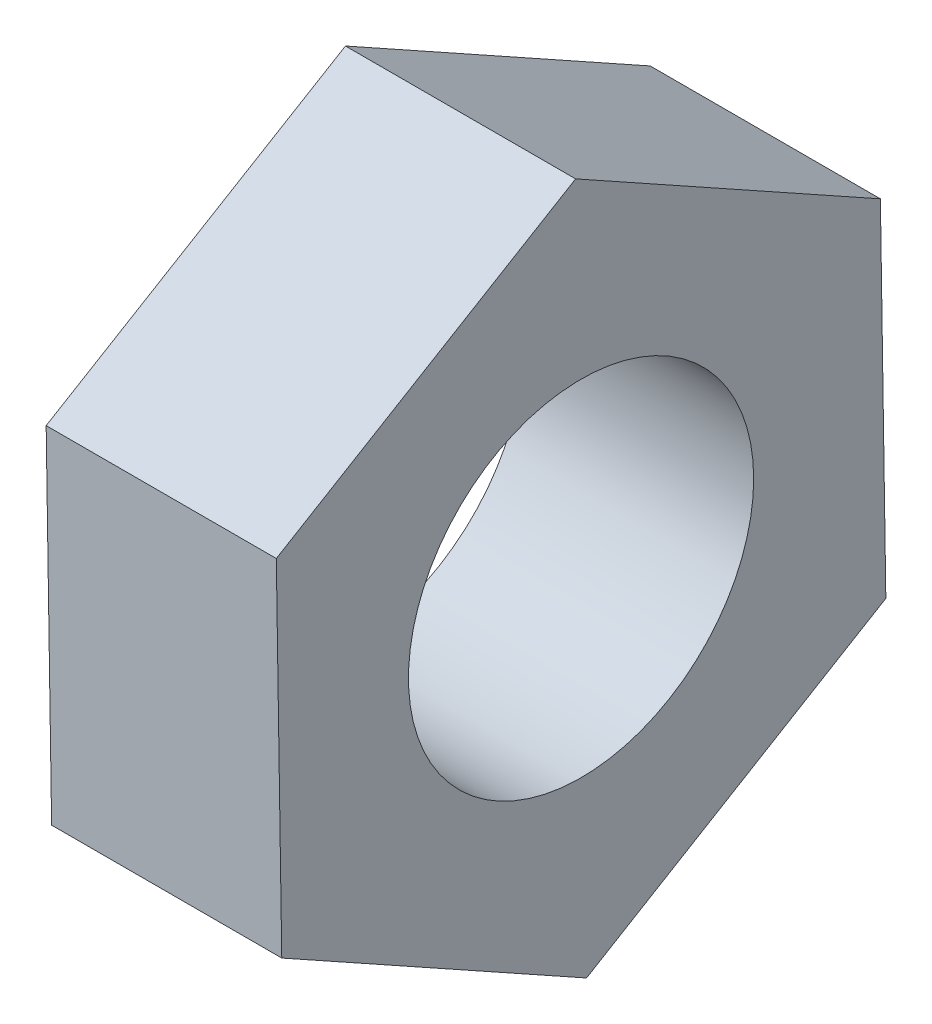
from build123d import *

# Parameters (mm, degrees)
SKETCH1_R           = 6
BOSS_EXTRUDE1_DEPTH = 8


with BuildPart() as part:
    # Sketch1 → Boss-Extrude1 (new body)
    with BuildSketch(Plane(origin=(0, 0, 0), x_dir=(0, 0, -1), z_dir=(1, 0, 0))):
        Polygon((10.593592918, -5.897100058), (10.403834918, 6.225770555), (-0.189758, 12.122870613), (-10.593592918, 5.897100058), (-10.403834918, -6.225770555), (0.189758, -12.122870613), align=None)
        Circle(SKETCH1_R, mode=Mode.SUBTRACT)
    extrude(amount=BOSS_EXTRUDE1_DEPTH)


solid = part.part
